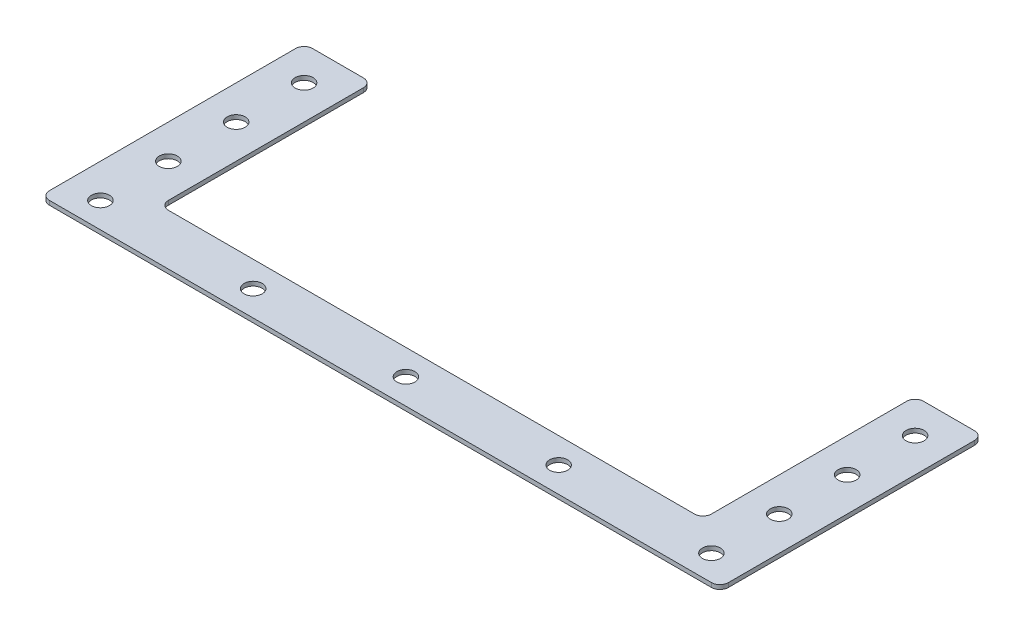
from build123d import *

# Parameters (mm, degrees)
SKETCH1_W                     = 25.4
SKETCH1_H                     = 98.425
SKETCH1_W_2                   = 203.2
SKETCH1_H_2                   = 19.05
BOSS_EXTRUDE1_DEPTH           = 1.5875
FILLET2_R                     = 3.175
TAP_DRILL_FOR_1_4_HELICOIL0_D = 6.7564


with BuildPart() as part:
    # Sketch1 → Boss-Extrude1 (new body)
    with BuildSketch(Plane(origin=(0, 0, 0), x_dir=(1, 0, 0), z_dir=(0, 1, 0))):
        with Locations((-114.3, 0)):
            Rectangle(SKETCH1_W, SKETCH1_H)
        with Locations((0, -39.6875)):
            Rectangle(SKETCH1_W_2, SKETCH1_H_2)
        Polygon((101.6, 49.2125), (101.6, -30.1625), (101.6, -49.2125), (127, -49.2125), (127, 49.2125), align=None)
    extrude(amount=BOSS_EXTRUDE1_DEPTH)

    # Fillet2
    fillet2_edges = [part.edges().sort_by_distance(p)[0] for p in [
        (-101.6, 0.79375, 30.1625),
        (101.6, 0.79375, 30.1625),
        (101.6, 0.79375, -49.2125),
        (127, 0.79375, -49.2125),
        (127, 0.79375, 49.2125),
        (-127, 0.79375, 49.2125),
        (-127, 0.79375, -49.2125),
        (-101.6, 0.79375, -49.2125),
    ]]
    fillet(fillet2_edges, radius=FILLET2_R)

    # Tap Drill for 1/4 Helicoil0 (through all)
    with Locations(Plane(origin=(0, 1.5875, 0), x_dir=(1, 0, 0), z_dir=(0, 1, 0))):
        with Locations((-114.3, 36.5125), (-114.3, 11.1125), (-114.3, -14.2875), (-57.15, -39.6875), (0, -39.6875), (57.15, -39.6875), (114.3, -14.2875), (114.3, 11.1125), (114.3, 36.5125), (-114.3, -39.6875), (114.3, -39.6875)):
            Hole(TAP_DRILL_FOR_1_4_HELICOIL0_D / 2)


solid = part.part
